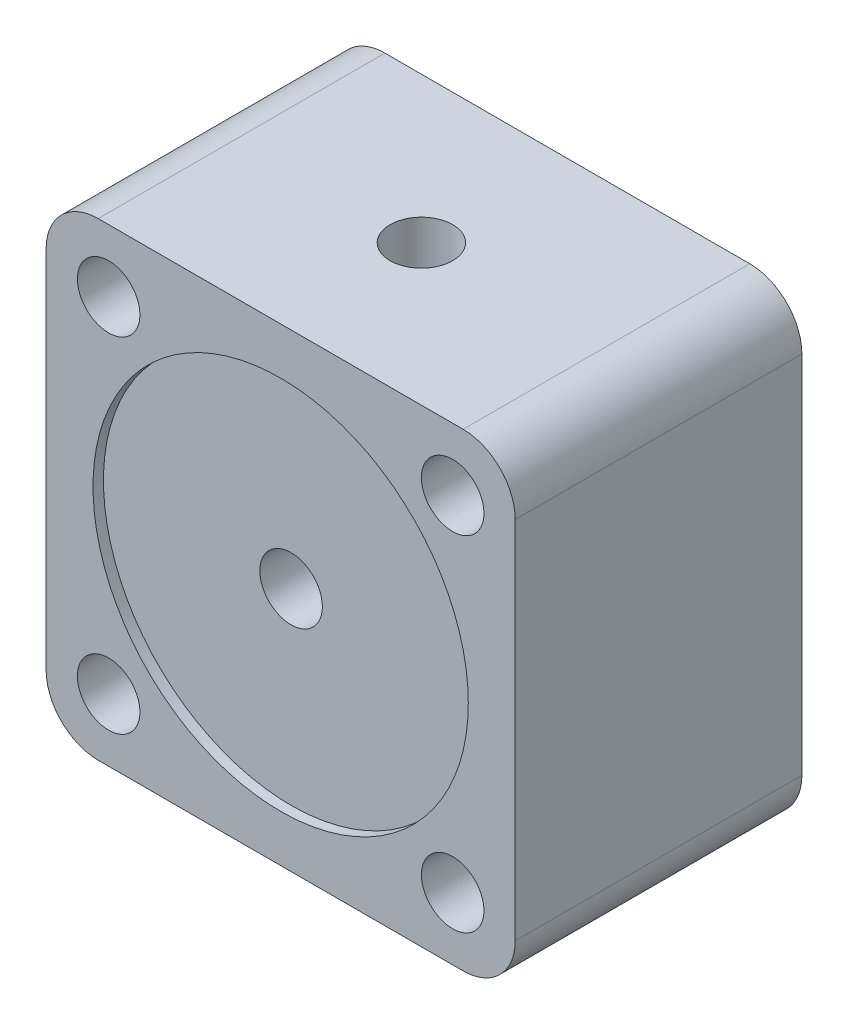
from build123d import *

# Parameters (mm, degrees)
SKETCH1_R           = 3
BOSS_EXTRUDE1_DEPTH = 27.5
SKETCH3_R           = 18
CUT_EXTRUDE1_DEPTH  = 1
SKETCH7_R           = 3
CUT_EXTRUDE2_DEPTH  = 20
SKETCH8_R           = 3
CUT_EXTRUDE3_DEPTH  = 16


with BuildPart() as part:
    # Sketch1 → Boss-Extrude1 (new body)
    with BuildSketch(Plane.XY):
        with BuildLine():
            Line((0, 40), (0, 5))
            ThreePointArc((0, 5), (-1.464466094, 1.464466094), (-5, 0))
            Line((-5, 0), (-40, 0))
            ThreePointArc((-40, 0), (-43.535533906, 1.464466094), (-45, 5))
            Line((-45, 5), (-45, 40))
            ThreePointArc((-45, 40), (-43.535533906, 43.535533906), (-40, 45))
            Line((-40, 45), (-5, 45))
            ThreePointArc((-5, 45), (-1.464466094, 43.535533906), (0, 40))
        make_face()
        with Locations((-6, 39)):
            Circle(SKETCH1_R, mode=Mode.SUBTRACT)
        with Locations((-6, 6)):
            Circle(SKETCH1_R, mode=Mode.SUBTRACT)
        with Locations(Location((-39, 6, 0), (0, 0, 180))):
            Circle(SKETCH1_R, mode=Mode.SUBTRACT)
        with Locations(Location((-39, 39, 0), (0, 0, 180))):
            Circle(SKETCH1_R, mode=Mode.SUBTRACT)
    extrude(amount=BOSS_EXTRUDE1_DEPTH)

    # Sketch3 → Cut-Extrude1 (cut)
    with BuildSketch(Plane.XY.offset(27.5)):
        with Locations((-22.5, 22.5)):
            Circle(SKETCH3_R)
    extrude(amount=-CUT_EXTRUDE1_DEPTH, mode=Mode.SUBTRACT)

    # Sketch7 → Cut-Extrude2 (cut)
    with BuildSketch(Plane(origin=(0, 45, 0), x_dir=(1, 0, 0), z_dir=(0, 1, 0))):
        with Locations(Location((-22.5, -14, 0), (0, 0, 180))):
            Circle(SKETCH7_R)
    extrude(amount=-CUT_EXTRUDE2_DEPTH, mode=Mode.SUBTRACT)

    # Sketch8 → Cut-Extrude3 (cut)
    with BuildSketch(Plane.XY.offset(26.5)):
        with Locations((-22.5, 22.5)):
            Circle(SKETCH8_R)
    extrude(amount=-CUT_EXTRUDE3_DEPTH, mode=Mode.SUBTRACT)


solid = part.part
